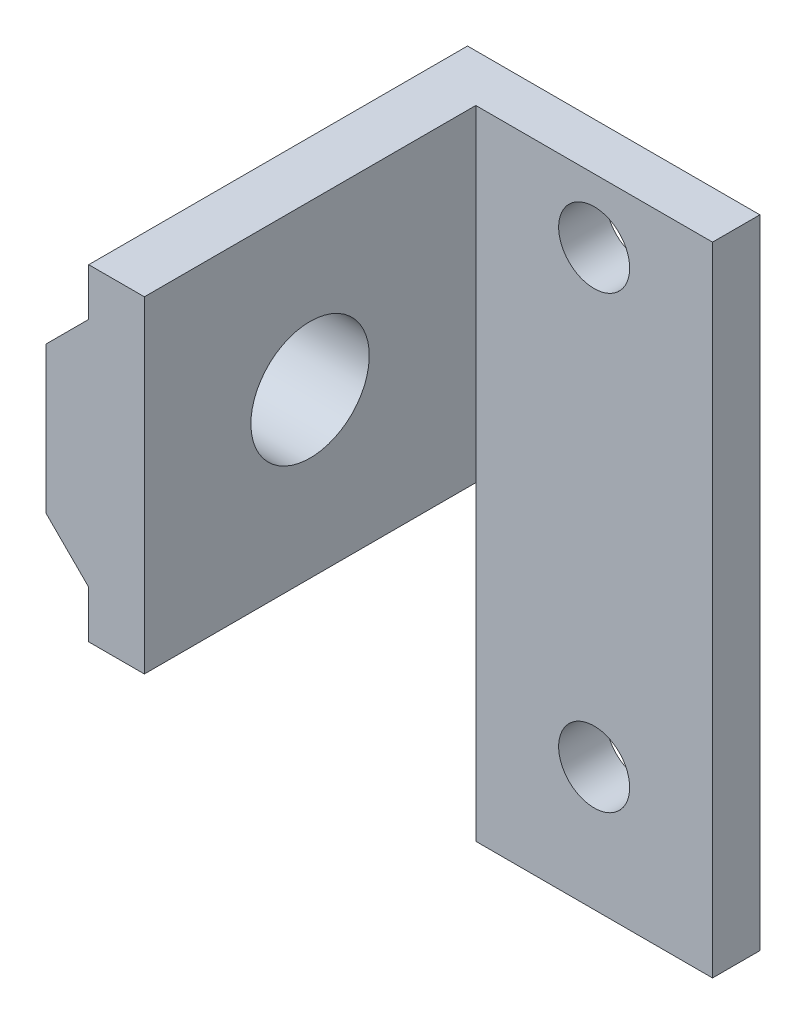
from build123d import *

# Parameters (mm, degrees)
SKETCH1_W           = 10
SKETCH1_H           = 26.92
SKETCH1_R           = 1.5
BOSS_EXTRUDE1_DEPTH = 2
BOSS_EXTRUDE2_DEPTH = 16
SKETCH5_R           = 2.5
CUT_EXTRUDE1_DEPTH  = 16


with BuildPart() as part:
    # Sketch1 → Boss-Extrude1 (new body)
    with BuildSketch(Plane.XY):
        with Locations((5, 13.46)):
            Rectangle(SKETCH1_W, SKETCH1_H)
        with Locations((5, 24.22)):
            Circle(SKETCH1_R, mode=Mode.SUBTRACT)
        with Locations((5, 5.22)):
            Circle(SKETCH1_R, mode=Mode.SUBTRACT)
    extrude(amount=BOSS_EXTRUDE1_DEPTH)

    # Sketch2 → Boss-Extrude2 (add)
    with BuildSketch(Plane(origin=(0, 0, 0), x_dir=(-1, 0, 0), z_dir=(0, 0, -1))):
        Polygon((2.35, 24.92), (4.15, 23.12), (4.15, 16.92), (2.35, 15.12), (2.35, 13.12), (0, 13.12), (0, 15.12), (0, 24.92), (0, 26.92), (2.35, 26.92), align=None)
    extrude(amount=-BOSS_EXTRUDE2_DEPTH)

    # Sketch5 → Cut-Extrude1 (cut)
    with BuildSketch(Plane(origin=(0, 0, 0), x_dir=(0, 0, -1), z_dir=(1, 0, 0))):
        with Locations(Location((-9, 20.02, 0), (0, 0, 90))):
            Circle(SKETCH5_R)
    extrude(amount=-CUT_EXTRUDE1_DEPTH, mode=Mode.SUBTRACT)


solid = part.part
